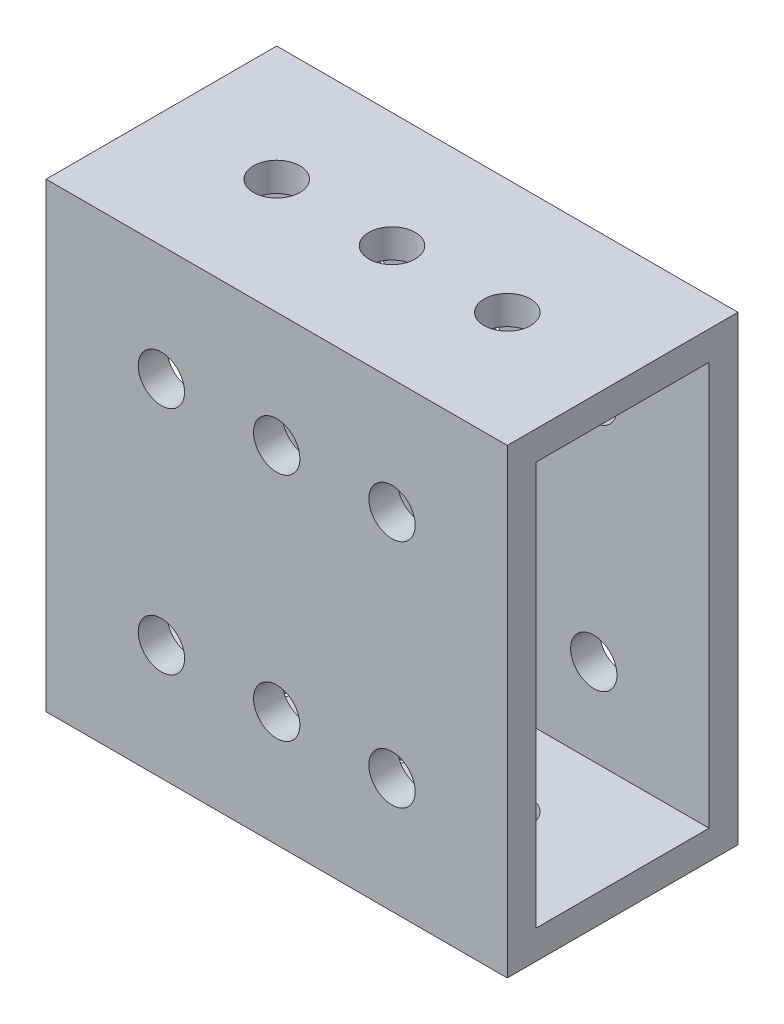
from build123d import *

# Parameters (mm, degrees)
SKETCH1_W           = 50.8
SKETCH1_H           = 50.8
BOSS_EXTRUDE1_DEPTH = 25.4
SKETCH2_W           = 19.05
SKETCH2_H           = 44.45
CUT_EXTRUDE1_DEPTH  = 77.2
SKETCH3_R           = 2.5527
CUT_EXTRUDE2_DEPTH  = 77.2
SKETCH4_R           = 2.5527
CUT_EXTRUDE3_DEPTH  = 77.2


with BuildPart() as part:
    # Sketch1 → Boss-Extrude1 (new body)
    with BuildSketch(Plane.XY):
        with Locations((25.4, 25.4)):
            Rectangle(SKETCH1_W, SKETCH1_H)
    extrude(amount=BOSS_EXTRUDE1_DEPTH)

    # Sketch2 → Cut-Extrude1 (cut, through all)
    with BuildSketch(Plane(origin=(50.8, 0, 0), x_dir=(0, 0, -1), z_dir=(1, 0, 0))):
        with Locations((-12.7, 25.4)):
            Rectangle(SKETCH2_W, SKETCH2_H)
    extrude(amount=-CUT_EXTRUDE1_DEPTH, mode=Mode.SUBTRACT)

    # Sketch3 → Cut-Extrude2 (cut, through all)
    with BuildSketch(Plane(origin=(0, 50.8, 0), x_dir=(1, 0, 0), z_dir=(0, 1, 0))):
        with Locations(Location((12.7, -12.7, 0), (0, 0, 270))):
            Circle(SKETCH3_R)
        with Locations(Location((25.4, -12.7, 0), (0, 0, 270))):
            Circle(SKETCH3_R)
        with Locations(Location((38.1, -12.7, 0), (0, 0, 270))):
            Circle(SKETCH3_R)
    extrude(amount=-CUT_EXTRUDE2_DEPTH, mode=Mode.SUBTRACT)

    # Sketch4 → Cut-Extrude3 (cut, through all)
    with BuildSketch(Plane(origin=(0, 0, 0), x_dir=(-1, 0, 0), z_dir=(0, 0, -1))):
        with Locations((-38.1, 38.1)):
            Circle(SKETCH4_R)
        with Locations((-25.4, 38.1)):
            Circle(SKETCH4_R)
        with Locations((-12.7, 38.1)):
            Circle(SKETCH4_R)
        with Locations((-38.1, 12.7)):
            Circle(SKETCH4_R)
        with Locations((-25.4, 12.7)):
            Circle(SKETCH4_R)
        with Locations((-12.7, 12.7)):
            Circle(SKETCH4_R)
    extrude(amount=-CUT_EXTRUDE3_DEPTH, mode=Mode.SUBTRACT)


solid = part.part
